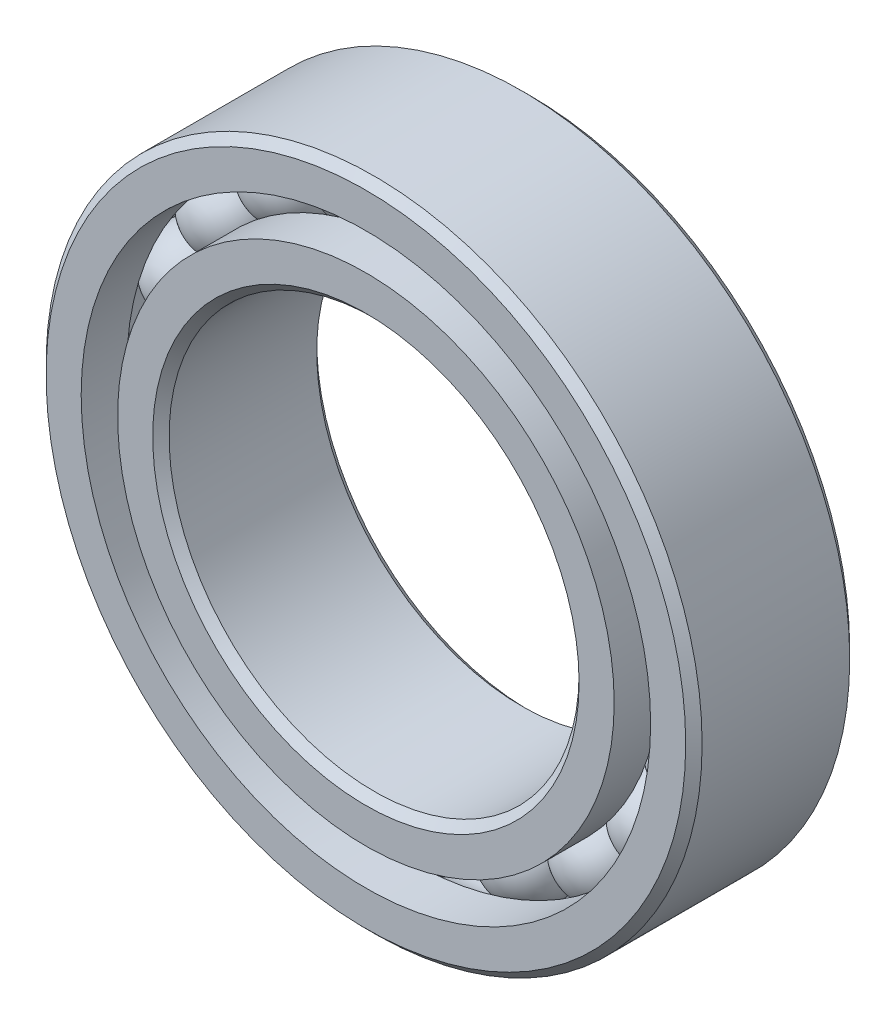
from build123d import *

# Parameters (mm, degrees)
CIRPATTERN1_COUNT = 20


with BuildPart() as part:
    # Sketch2 → Revolve1 (revolve)
    with BuildSketch(Plane(origin=(0, 0, 0), x_dir=(0, 0, -1), z_dir=(1, 0, 0))):
        with BuildLine():
            Line((-1, 3.027777778), (-0.444444444, 3.027777778))
            ThreePointArc((-0.444444444, 3.027777778), (0, 2.753096005), (0.444444444, 3.027777778))
            Line((0.444444444, 3.027777778), (1, 3.027777778))
            Line((1, 3.027777778), (1, 2.6))
            Line((1, 2.6), (0.9, 2.5))
            Line((0.9, 2.5), (-0.9, 2.5))
            Line((-0.9, 2.5), (-1, 2.6))
            Line((-1, 2.6), (-1, 3.027777778))
        make_face()
        with BuildLine():
            Line((0.9, 4), (1, 3.9))
            Line((1, 3.9), (1, 3.472222222))
            Line((1, 3.472222222), (0.444444444, 3.472222222))
            ThreePointArc((0.444444444, 3.472222222), (0, 3.746903995), (-0.444444444, 3.472222222))
            Line((-0.444444444, 3.472222222), (-1, 3.472222222))
            Line((-1, 3.472222222), (-1, 3.9))
            Line((-1, 3.9), (-0.9, 4))
            Line((-0.9, 4), (0.9, 4))
        make_face()
    revolve(axis=Axis((0, 0, 1), (0, 0, -1)))


with BuildPart() as body_2:
    # Sketch3 → Revolve2 (revolve)
    with BuildSketch(Plane(origin=(0, 0, 0), x_dir=(0, 0, -1), z_dir=(1, 0, 0))):
        with BuildLine():
            Line((-0.496903995, 3.25), (0.496903995, 3.25))
            ThreePointArc((0.496903995, 3.25), (0, 3.746903995), (-0.496903995, 3.25))
        make_face()
    revolve(axis=Axis((0, 3.25, 0.496903995), (0, 0, -1)))


with BuildPart() as cirpattern1_1:
    # CirPattern1: pattern copy
    add(body_2.part.rotate(Axis((0, 0, -1), (0, 0, 1)), 1 * 360 / CIRPATTERN1_COUNT))


with BuildPart() as cirpattern1_2:
    # CirPattern1: pattern copy
    add(body_2.part.rotate(Axis((0, 0, -1), (0, 0, 1)), 2 * 360 / CIRPATTERN1_COUNT))


with BuildPart() as cirpattern1_3:
    # CirPattern1: pattern copy
    add(body_2.part.rotate(Axis((0, 0, -1), (0, 0, 1)), 3 * 360 / CIRPATTERN1_COUNT))


with BuildPart() as cirpattern1_4:
    # CirPattern1: pattern copy
    add(body_2.part.rotate(Axis((0, 0, -1), (0, 0, 1)), 4 * 360 / CIRPATTERN1_COUNT))


with BuildPart() as cirpattern1_5:
    # CirPattern1: pattern copy
    add(body_2.part.rotate(Axis((0, 0, -1), (0, 0, 1)), 5 * 360 / CIRPATTERN1_COUNT))


with BuildPart() as cirpattern1_6:
    # CirPattern1: pattern copy
    add(body_2.part.rotate(Axis((0, 0, -1), (0, 0, 1)), 6 * 360 / CIRPATTERN1_COUNT))


with BuildPart() as cirpattern1_7:
    # CirPattern1: pattern copy
    add(body_2.part.rotate(Axis((0, 0, -1), (0, 0, 1)), 7 * 360 / CIRPATTERN1_COUNT))


with BuildPart() as cirpattern1_8:
    # CirPattern1: pattern copy
    add(body_2.part.rotate(Axis((0, 0, -1), (0, 0, 1)), 8 * 360 / CIRPATTERN1_COUNT))


with BuildPart() as cirpattern1_9:
    # CirPattern1: pattern copy
    add(body_2.part.rotate(Axis((0, 0, -1), (0, 0, 1)), 9 * 360 / CIRPATTERN1_COUNT))


with BuildPart() as cirpattern1_10:
    # CirPattern1: pattern copy
    add(body_2.part.rotate(Axis((0, 0, -1), (0, 0, 1)), 10 * 360 / CIRPATTERN1_COUNT))


with BuildPart() as cirpattern1_11:
    # CirPattern1: pattern copy
    add(body_2.part.rotate(Axis((0, 0, -1), (0, 0, 1)), 11 * 360 / CIRPATTERN1_COUNT))


with BuildPart() as cirpattern1_12:
    # CirPattern1: pattern copy
    add(body_2.part.rotate(Axis((0, 0, -1), (0, 0, 1)), 12 * 360 / CIRPATTERN1_COUNT))


with BuildPart() as cirpattern1_13:
    # CirPattern1: pattern copy
    add(body_2.part.rotate(Axis((0, 0, -1), (0, 0, 1)), 13 * 360 / CIRPATTERN1_COUNT))


with BuildPart() as cirpattern1_14:
    # CirPattern1: pattern copy
    add(body_2.part.rotate(Axis((0, 0, -1), (0, 0, 1)), 14 * 360 / CIRPATTERN1_COUNT))


with BuildPart() as cirpattern1_15:
    # CirPattern1: pattern copy
    add(body_2.part.rotate(Axis((0, 0, -1), (0, 0, 1)), 15 * 360 / CIRPATTERN1_COUNT))


with BuildPart() as cirpattern1_16:
    # CirPattern1: pattern copy
    add(body_2.part.rotate(Axis((0, 0, -1), (0, 0, 1)), 16 * 360 / CIRPATTERN1_COUNT))


with BuildPart() as cirpattern1_17:
    # CirPattern1: pattern copy
    add(body_2.part.rotate(Axis((0, 0, -1), (0, 0, 1)), 17 * 360 / CIRPATTERN1_COUNT))


with BuildPart() as cirpattern1_18:
    # CirPattern1: pattern copy
    add(body_2.part.rotate(Axis((0, 0, -1), (0, 0, 1)), 18 * 360 / CIRPATTERN1_COUNT))


with BuildPart() as cirpattern1_19:
    # CirPattern1: pattern copy
    add(body_2.part.rotate(Axis((0, 0, -1), (0, 0, 1)), 19 * 360 / CIRPATTERN1_COUNT))


solid = Compound([part.part, body_2.part, cirpattern1_1.part, cirpattern1_2.part, cirpattern1_3.part, cirpattern1_4.part, cirpattern1_5.part, cirpattern1_6.part, cirpattern1_7.part, cirpattern1_8.part, cirpattern1_9.part, cirpattern1_10.part, cirpattern1_11.part, cirpattern1_12.part, cirpattern1_13.part, cirpattern1_14.part, cirpattern1_15.part, cirpattern1_16.part, cirpattern1_17.part, cirpattern1_18.part, cirpattern1_19.part])
